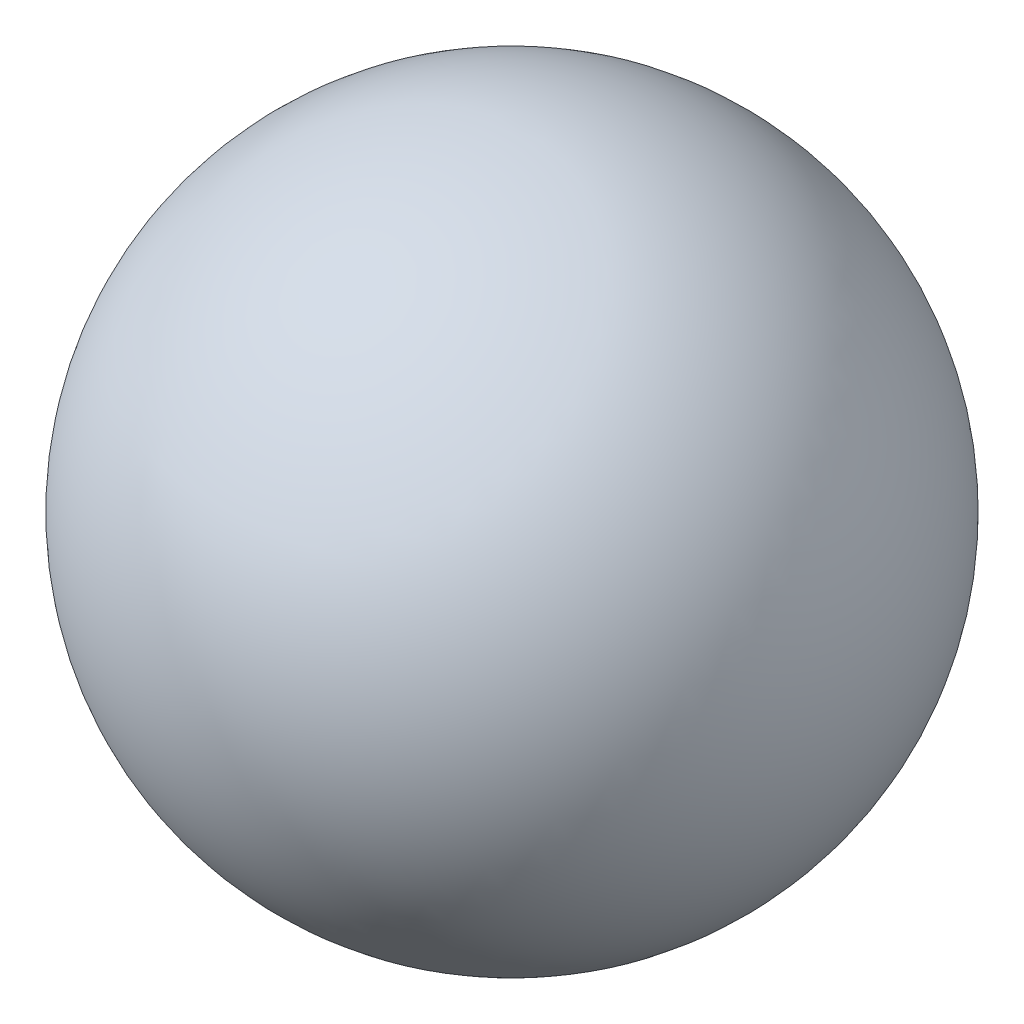
from build123d import *


with BuildPart() as part:
    # Sketch1 → Revolve1 (revolve)
    with BuildSketch(Plane.XY):
        with BuildLine():
            Line((0, 95), (0, -95))
            ThreePointArc((0, -95), (-95, 0), (0, 95))
        make_face()
    revolve(axis=Axis((0, -95, 0), (0, 1, 0)))


solid = part.part
